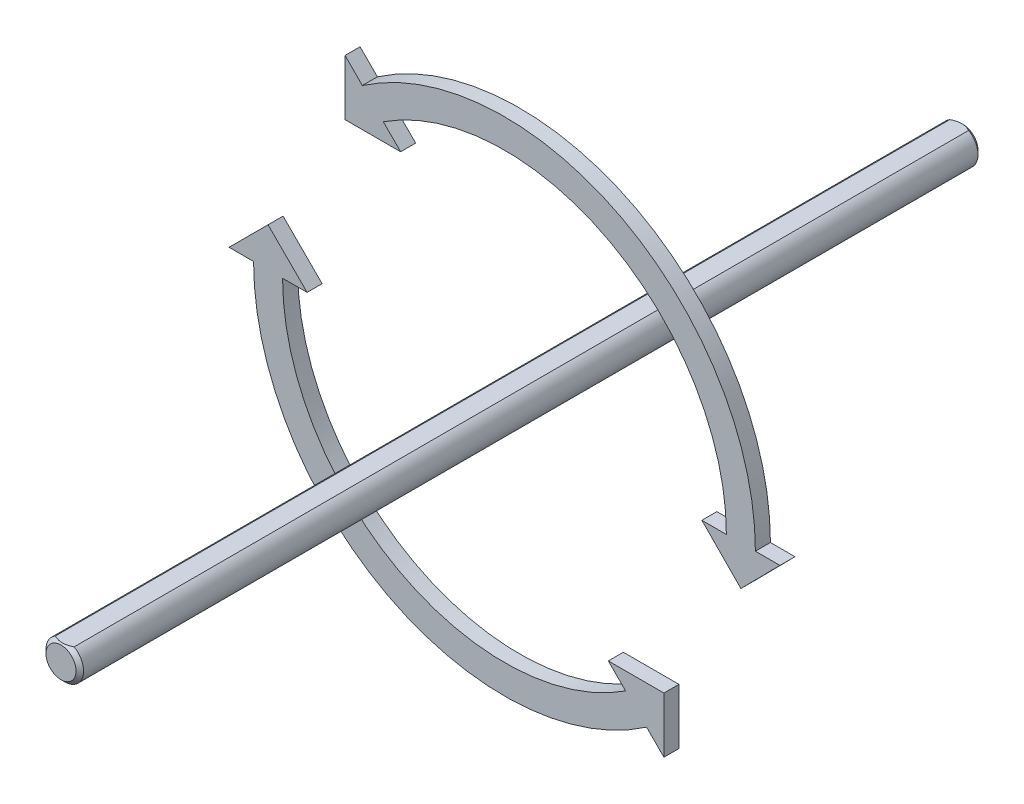
from build123d import *

# Parameters (mm, degrees)
SKETCH1_R                  = 3.175
EXTRUDE1_DEPTH             = 76.2
CHAMFER1_SIZE              = 0.635
EXTRUDE7_DEPTH             = 77.332177029
EXTRUDE7_DEPTH_BACK        = 77.332177029
BOSS_EXTRUDE1_DEPTH        = 1.27
BOSS_EXTRUDE1_DEPTH_BACK   = 1.27
BOSS_EXTRUDE1_2_DEPTH      = 1.27
BOSS_EXTRUDE1_2_DEPTH_BACK = 1.27


with BuildPart() as part:
    # Sketch1 → Extrude1 (new, symmetric)
    with BuildSketch(Plane.XY):
        Circle(SKETCH1_R)
    extrude(amount=EXTRUDE1_DEPTH, both=True)

    # Chamfer1
    chamfer1_edges = [part.edges().sort_by_distance(p)[0] for p in [
        (-3.175, 0, -76.2),
        (-3.175, 0, 76.2),
    ]]
    chamfer(chamfer1_edges, length=CHAMFER1_SIZE)

    # Sketch13 → Extrude7 (cut, two sides: drawn at the far end of the back side and taken through both)
    with BuildSketch(Plane.XY.offset(-EXTRUDE7_DEPTH_BACK)):
        with BuildLine():
            Line((-1.5875, 2.749630657), (1.5875, 2.749630657))
            ThreePointArc((1.5875, 2.749630657), (0, 3.175), (-1.5875, 2.749630657))
        make_face()
    extrude(amount=EXTRUDE7_DEPTH + EXTRUDE7_DEPTH_BACK, mode=Mode.SUBTRACT)


with BuildPart() as body_2:
    # Sketch16 → Boss-Extrude1 (new, two sides: drawn at the far end of the back side and taken through both)
    with BuildSketch(Plane.XY.offset(-BOSS_EXTRUDE1_DEPTH_BACK)):
        with BuildLine():
            Line((-17.542718978, 28.479648421), (-20.475297312, 31.412226755))
            ThreePointArc((-20.475297312, 31.412226755), (17.863646534, 32.967497968), (37.496210339, 0))
            Line((37.496210339, 0), (33.348918286, 0))
            Line((33.348918286, 0), (39.946532873, -6.692163745))
            Line((39.946532873, -6.692163745), (46.54414746, 0))
            Line((46.54414746, 0), (42.396855407, 0))
            ThreePointArc((42.396855407, 0), (19.743905376, 37.518949197), (-24.007670842, 34.944600285))
            Line((-24.007670842, 34.944600285), (-26.940249176, 37.877178619))
            Line((-26.940249176, 37.877178619), (-26.940249176, 28.479648421))
            Line((-26.940249176, 28.479648421), (-17.542718978, 28.479648421))
        make_face()
    extrude(amount=BOSS_EXTRUDE1_DEPTH + BOSS_EXTRUDE1_DEPTH_BACK)


with BuildPart() as body_3:
    # Sketch16 → Boss-Extrude1 2 (new, two sides: drawn at the far end of the back side and taken through both)
    with BuildSketch(Plane.XY.offset(-BOSS_EXTRUDE1_2_DEPTH_BACK)):
        with BuildLine():
            Line((17.542718978, -28.479648421), (20.475297312, -31.412226755))
            ThreePointArc((20.475297312, -31.412226755), (-17.863646534, -32.967497968), (-37.496210339, 0))
            Line((-37.496210339, 0), (-33.348918286, 0))
            Line((-33.348918286, 0), (-39.946532873, 6.597614587))
            Line((-39.946532873, 6.597614587), (-46.54414746, 0))
            Line((-46.54414746, 0), (-42.396855407, 0))
            ThreePointArc((-42.396855407, 0), (-19.743905376, -37.518949197), (24.007670842, -34.944600285))
            Line((24.007670842, -34.944600285), (26.940249176, -37.877178619))
            Line((26.940249176, -37.877178619), (26.940249176, -28.479648421))
            Line((26.940249176, -28.479648421), (17.542718978, -28.479648421))
        make_face()
    extrude(amount=BOSS_EXTRUDE1_2_DEPTH + BOSS_EXTRUDE1_2_DEPTH_BACK)


solid = Compound([part.part, body_2.part, body_3.part])
